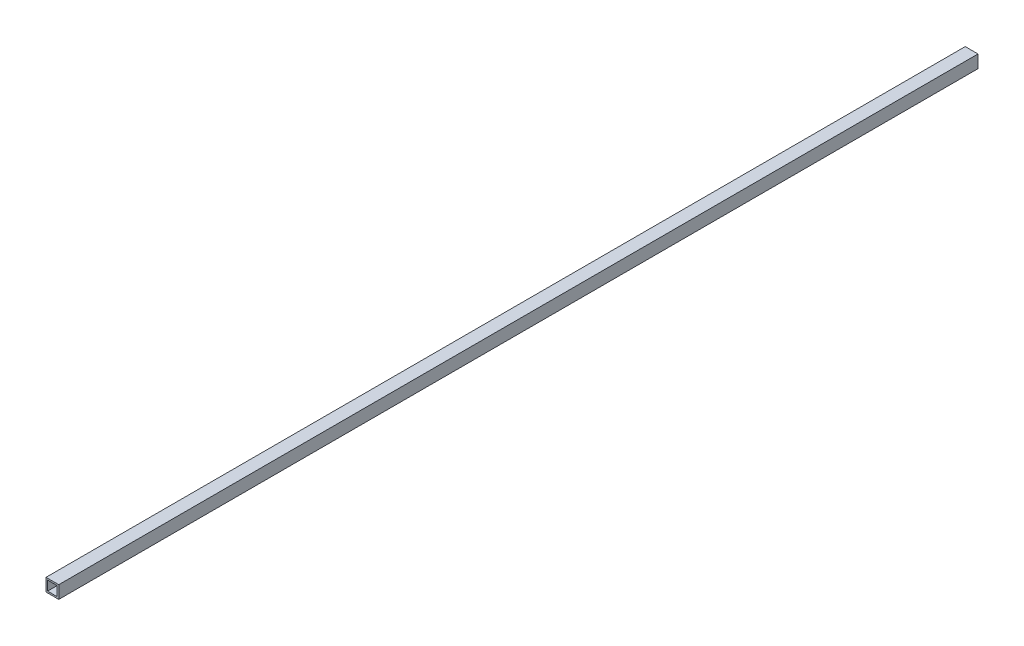
from build123d import *

# Parameters (mm, degrees)
BOSS_EXTRUDE1_DEPTH      = 457.2
BOSS_EXTRUDE1_DEPTH_BACK = 457.2
SKETCH3_W                = 12.7
SKETCH3_H                = 12.7
SKETCH3_W_2              = 9.525
SKETCH3_H_2              = 9.525


with BuildPart() as part:
    # Sketch3 → Boss-Extrude1 (new, two sides: drawn at the far end of the back side and taken through both)
    with BuildSketch(Plane.XY.offset(-BOSS_EXTRUDE1_DEPTH_BACK)):
        Rectangle(SKETCH3_W, SKETCH3_H)
        Rectangle(SKETCH3_W_2, SKETCH3_H_2, mode=Mode.SUBTRACT)
    extrude(amount=BOSS_EXTRUDE1_DEPTH + BOSS_EXTRUDE1_DEPTH_BACK)


solid = part.part
